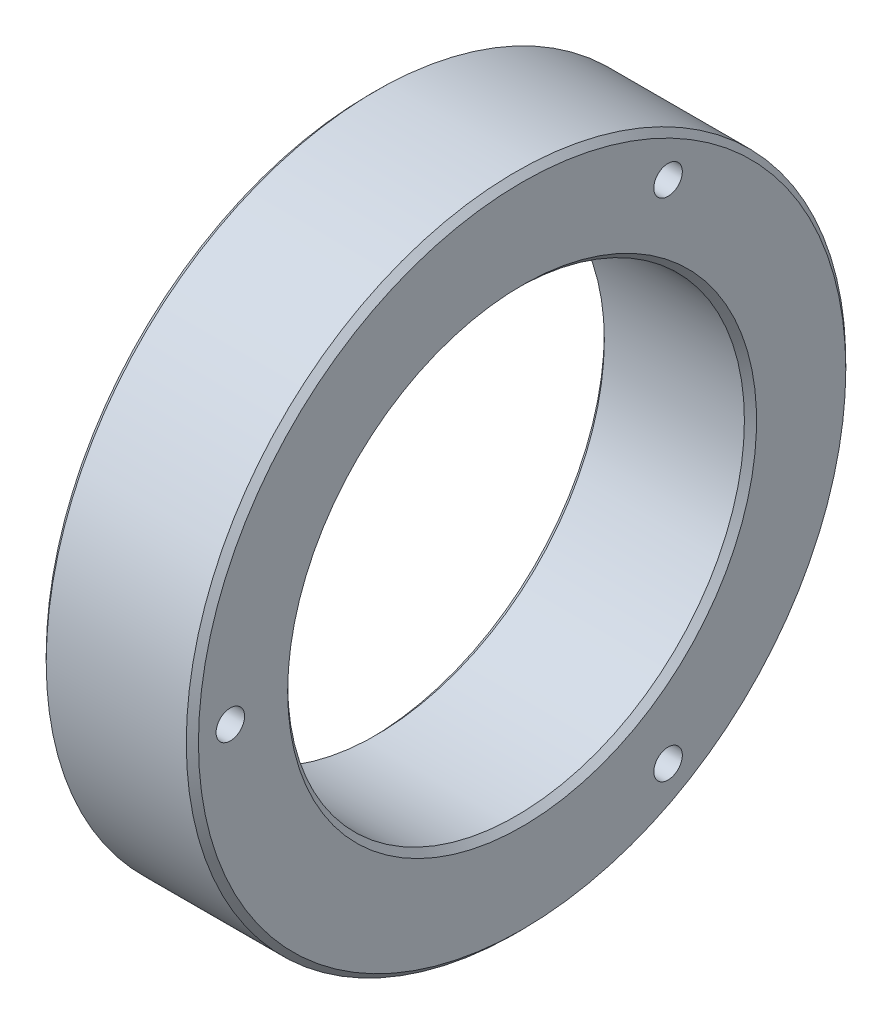
from build123d import *

# Parameters (mm, degrees)
SKETCH1_W           = 25.3746
SKETCH1_H           = 38.1
CHAMFER1_SIZE       = 1.524
SKETCH2_R           = 3.5687
CUT_EXTRUDE2_DEPTH  = 76.2
SKETCH3_R           = 5.5626
CUT_EXTRUDE4_DEPTH  = 9.652
SKETCH4_R           = 3.5687
CUT_EXTRUDE6_DEPTH  = 76.2
SKETCH5_R           = 5.5626
CUT_EXTRUDE8_DEPTH  = 9.652
SKETCH6_R           = 3.5687
CUT_EXTRUDE10_DEPTH = 76.2
SKETCH7_R           = 5.5626
CUT_EXTRUDE12_DEPTH = 9.652
SKETCH8_R           = 3.96875
CUT_EXTRUDE14_DEPTH = 25.4
SKETCH9_R           = 3.96875
CUT_EXTRUDE16_DEPTH = 25.4


with BuildPart() as part:
    # Sketch1 → Revolve1 (revolve)
    with BuildSketch(Plane(origin=(0, 0, 0), x_dir=(0, 1, 0), z_dir=(0, 0, 1)), mode=Mode.PRIVATE) as revolve1_sk:
        with Locations((69.8373, -19.05)):
            Rectangle(SKETCH1_W, SKETCH1_H)
    revolve(revolve1_sk.sketch.rotate(Axis((-25.4, 0, 0), (1, 0, 0)), 90), axis=Axis((-25.4, 0, 0), (1, 0, 0)))

    # Chamfer1
    chamfer1_edges = [part.edges().sort_by_distance(p)[0] for p in [
        (0, 0, -57.15),
        (38.1, 0, -57.15),
        (38.1, 0, -82.5246),
        (0, 0, -82.5246),
    ]]
    chamfer(chamfer1_edges, length=CHAMFER1_SIZE)

    # Sketch2 → Cut-Extrude2 (cut)
    with BuildSketch(Plane.YZ):
        with Locations(Location((0, 73.025, 0), (0, 0, 90))):
            Circle(SKETCH2_R)
    extrude(amount=CUT_EXTRUDE2_DEPTH, mode=Mode.SUBTRACT)

    # Sketch3 → Cut-Extrude4 (cut)
    with BuildSketch(Plane.YZ):
        with Locations(Location((0, 73.025, 0), (0, 0, 270))):
            Circle(SKETCH3_R)
    extrude(amount=CUT_EXTRUDE4_DEPTH, mode=Mode.SUBTRACT)

    # Sketch4 → Cut-Extrude6 (cut)
    with BuildSketch(Plane.YZ):
        with Locations(Location((-63.246, -36.5252, 0), (0, 0, 90))):
            Circle(SKETCH4_R)
    extrude(amount=CUT_EXTRUDE6_DEPTH, mode=Mode.SUBTRACT)

    # Sketch5 → Cut-Extrude8 (cut)
    with BuildSketch(Plane.YZ):
        with Locations(Location((-63.246, -36.5252, 0), (0, 0, 270))):
            Circle(SKETCH5_R)
    extrude(amount=CUT_EXTRUDE8_DEPTH, mode=Mode.SUBTRACT)

    # Sketch6 → Cut-Extrude10 (cut)
    with BuildSketch(Plane.YZ):
        with Locations(Location((63.246, -36.5252, 0), (0, 0, 90))):
            Circle(SKETCH6_R)
    extrude(amount=CUT_EXTRUDE10_DEPTH, mode=Mode.SUBTRACT)

    # Sketch7 → Cut-Extrude12 (cut)
    with BuildSketch(Plane.YZ):
        with Locations(Location((63.246, -36.5252, 0), (0, 0, 270))):
            Circle(SKETCH7_R)
    extrude(amount=CUT_EXTRUDE12_DEPTH, mode=Mode.SUBTRACT)

    # Sketch8 → Cut-Extrude14 (cut)
    with BuildSketch(Plane.YZ):
        with Locations(Location((-69.85, 0, 0), (0, 0, 270))):
            Circle(SKETCH8_R)
    extrude(amount=CUT_EXTRUDE14_DEPTH, mode=Mode.SUBTRACT)

    # Sketch9 → Cut-Extrude16 (cut)
    with BuildSketch(Plane.YZ):
        with Locations(Location((69.85, 0, 0), (0, 0, 270))):
            Circle(SKETCH9_R)
    extrude(amount=CUT_EXTRUDE16_DEPTH, mode=Mode.SUBTRACT)


solid = part.part
